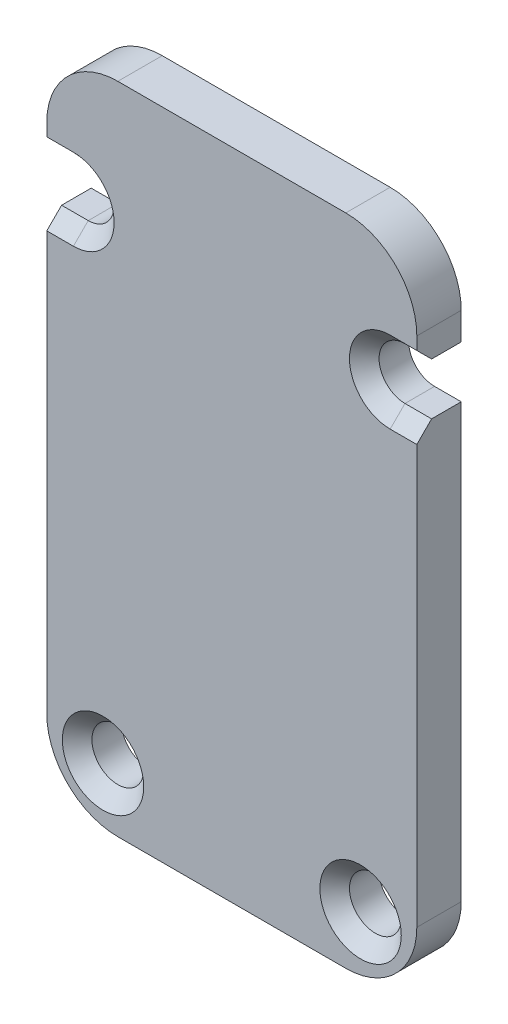
from build123d import *

# Parameters (mm, degrees)
SZKIC1_W                    = 25
SZKIC1_H                    = 44.2
DODANIE_WYCI_GNI_CIE1_DEPTH = 3
ZAOKR_GLENIE1_R             = 4.8
SZKIC2_R                    = 1.75
WYTNIJ_WYCI_GNI_CIE1_DEPTH  = 3
SFAZOWANIE1_SIZE            = 1


with BuildPart() as part:
    # Szkic1 → Dodanie-wyciągnięcie1 (new body)
    with BuildSketch(Plane.XY):
        Rectangle(SZKIC1_W, SZKIC1_H)
    extrude(amount=DODANIE_WYCI_GNI_CIE1_DEPTH)

    # Zaokrąglenie1
    zaokr_glenie1_edges = [part.edges().sort_by_distance(p)[0] for p in [
        (-12.5, 22.1, 1.5),
        (12.5, 22.1, 1.5),
        (12.5, -22.1, 1.5),
        (-12.5, -22.1, 1.5),
    ]]
    fillet(zaokr_glenie1_edges, radius=ZAOKR_GLENIE1_R)

    # Szkic2 → Wytnij-wyciągnięcie1 (cut)
    with BuildSketch(Plane.XY.offset(3)):
        with Locations((-8.7, -18.3)):
            Circle(SZKIC2_R)
        with Locations((8.7, -18.3)):
            Circle(SZKIC2_R)
        with BuildLine():
            Line((12.5, 11.95), (12.5, 15.45))
            Line((12.5, 15.45), (10.7, 15.45))
            ThreePointArc((10.7, 15.45), (11.937436867, 14.937436867), (12.45, 13.7))
            ThreePointArc((12.45, 13.7), (11.937436867, 12.462563133), (10.7, 11.95))
            Line((10.7, 11.95), (12.5, 11.95))
        make_face()
        with Locations((10.7, 13.7)):
            Circle(SZKIC2_R)
        with Locations((-10.7, 13.7)):
            Circle(SZKIC2_R)
        with BuildLine():
            ThreePointArc((-10.7, 11.95), (-12.45, 13.7), (-10.7, 15.45))
            Line((-10.7, 15.45), (-12.5, 15.45))
            Line((-12.5, 15.45), (-12.5, 11.95))
            Line((-12.5, 11.95), (-10.7, 11.95))
        make_face()
    extrude(amount=-WYTNIJ_WYCI_GNI_CIE1_DEPTH, mode=Mode.SUBTRACT)

    # Sfazowanie1
    sfazowanie1_edges = [part.edges().sort_by_distance(p)[0] for p in [
        (-11.6, 11.95, 3),
        (-8.95, 13.7, 3),
        (-11.6, 15.45, 3),
        (11.6, 11.95, 3),
        (11.6, 15.45, 3),
        (8.95, 13.7, 3),
        (6.95, -18.3, 3),
        (-10.45, -18.3, 3),
    ]]
    chamfer(sfazowanie1_edges, length=SFAZOWANIE1_SIZE)


solid = part.part
